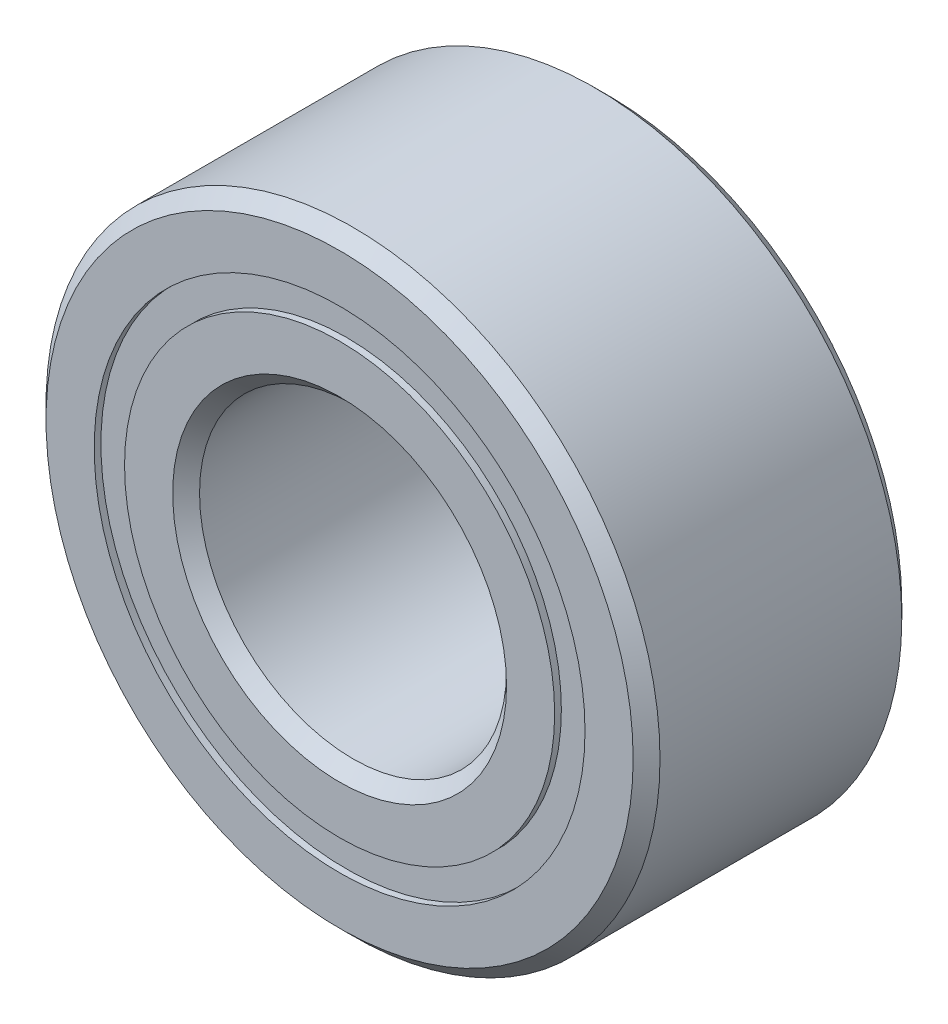
from build123d import *

# Parameters (mm, degrees)
CIRPATTERN1_COUNT = 10
SKETCH5_W         = 0.68259645
SKETCH5_H         = 0.31401099


with BuildPart() as part:
    # Sketch1 → Revolve1 (revolve)
    with BuildSketch(Plane(origin=(0, 0, 0), x_dir=(0, 0, -1), z_dir=(1, 0, 0))):
        with BuildLine():
            Line((1.25015625, 3.175), (-1.25015625, 3.175))
            Line((-1.25015625, 3.175), (-1.3890625, 3.03609375))
            Line((-1.3890625, 3.03609375), (-1.3890625, 2.538255495))
            Line((-1.3890625, 2.538255495), (-0.617361111, 2.538255495))
            ThreePointArc((-0.617361111, 2.538255495), (0, 3.018262925), (0.617361111, 2.538255495))
            Line((0.617361111, 2.538255495), (1.3890625, 2.538255495))
            Line((1.3890625, 2.538255495), (1.3890625, 3.03609375))
            Line((1.3890625, 3.03609375), (1.25015625, 3.175))
        make_face()
    revolve(axis=Axis((0, 0, 1.3890625), (0, 0, -1)))


with BuildPart() as body_2:
    # Sketch3 → Revolve3 (revolve)
    with BuildSketch(Plane(origin=(0, 0, 0), x_dir=(0, 0, -1), z_dir=(1, 0, 0))):
        with BuildLine():
            Line((-0.617361111, 2.224244505), (-1.3890625, 2.224244505))
            Line((-1.3890625, 2.224244505), (-1.3890625, 1.72640625))
            Line((-1.3890625, 1.72640625), (-1.25015625, 1.5875))
            Line((-1.25015625, 1.5875), (1.25015625, 1.5875))
            Line((1.25015625, 1.5875), (1.3890625, 1.72640625))
            Line((1.3890625, 1.72640625), (1.3890625, 2.224244505))
            Line((1.3890625, 2.224244505), (0.617361111, 2.224244505))
            ThreePointArc((0.617361111, 2.224244505), (0, 1.744237075), (-0.617361111, 2.224244505))
        make_face()
    revolve(axis=Axis((0, 0, 1.3890625), (0, 0, -1)))


with BuildPart() as body_3:
    # Sketch4 → Revolve4 (revolve)
    with BuildSketch(Plane(origin=(0, 0, 0), x_dir=(0, 0, -1), z_dir=(1, 0, 0))):
        with BuildLine():
            Line((-0.637012925, 2.38125), (0.637012925, 2.38125))
            ThreePointArc((0.637012925, 2.38125), (0, 3.018262925), (-0.637012925, 2.38125))
        make_face()
    revolve(axis=Axis((0, 2.38125, 0.637012925), (0, 0, -1)))


with BuildPart() as cirpattern1_1:
    # CirPattern1: pattern copy
    add(body_3.part.rotate(Axis((0, 0, -1.3890625), (0, 0, 1)), 1 * 360 / CIRPATTERN1_COUNT))


with BuildPart() as cirpattern1_2:
    # CirPattern1: pattern copy
    add(body_3.part.rotate(Axis((0, 0, -1.3890625), (0, 0, 1)), 2 * 360 / CIRPATTERN1_COUNT))


with BuildPart() as cirpattern1_3:
    # CirPattern1: pattern copy
    add(body_3.part.rotate(Axis((0, 0, -1.3890625), (0, 0, 1)), 3 * 360 / CIRPATTERN1_COUNT))


with BuildPart() as cirpattern1_4:
    # CirPattern1: pattern copy
    add(body_3.part.rotate(Axis((0, 0, -1.3890625), (0, 0, 1)), 4 * 360 / CIRPATTERN1_COUNT))


with BuildPart() as cirpattern1_5:
    # CirPattern1: pattern copy
    add(body_3.part.rotate(Axis((0, 0, -1.3890625), (0, 0, 1)), 5 * 360 / CIRPATTERN1_COUNT))


with BuildPart() as cirpattern1_6:
    # CirPattern1: pattern copy
    add(body_3.part.rotate(Axis((0, 0, -1.3890625), (0, 0, 1)), 6 * 360 / CIRPATTERN1_COUNT))


with BuildPart() as cirpattern1_7:
    # CirPattern1: pattern copy
    add(body_3.part.rotate(Axis((0, 0, -1.3890625), (0, 0, 1)), 7 * 360 / CIRPATTERN1_COUNT))


with BuildPart() as cirpattern1_8:
    # CirPattern1: pattern copy
    add(body_3.part.rotate(Axis((0, 0, -1.3890625), (0, 0, 1)), 8 * 360 / CIRPATTERN1_COUNT))


with BuildPart() as cirpattern1_9:
    # CirPattern1: pattern copy
    add(body_3.part.rotate(Axis((0, 0, -1.3890625), (0, 0, 1)), 9 * 360 / CIRPATTERN1_COUNT))


with BuildPart() as body_13:
    # Sketch5 → Revolve5 (revolve)
    with BuildSketch(Plane(origin=(0, 0, 0), x_dir=(0, 0, -1), z_dir=(1, 0, 0))):
        with Locations((-0.97831115, 2.38125)):
            Rectangle(SKETCH5_W, SKETCH5_H)
        with Locations((0.97831115, 2.38125)):
            Rectangle(SKETCH5_W, SKETCH5_H)
    revolve(axis=Axis((0, 0, 1.3890625), (0, 0, -1)))


solid = Compound([part.part, body_2.part, body_3.part, cirpattern1_1.part, cirpattern1_2.part, cirpattern1_3.part, cirpattern1_4.part, cirpattern1_5.part, cirpattern1_6.part, cirpattern1_7.part, cirpattern1_8.part, cirpattern1_9.part, body_13.part])
